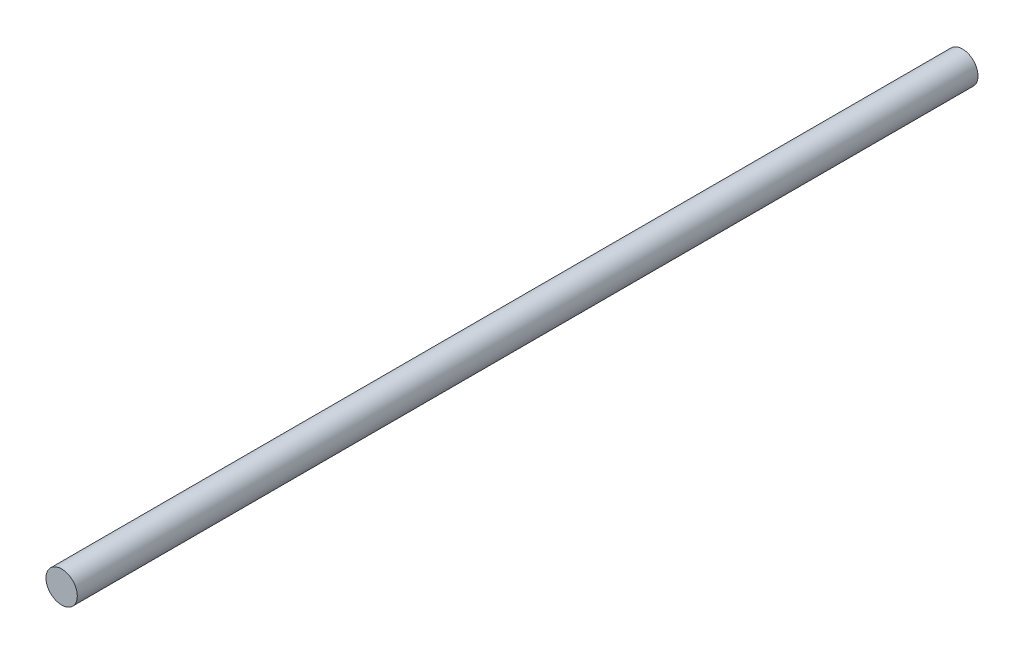
from build123d import *

# Parameters (mm, degrees)
SKETCH1_R           = 4
BOSS_EXTRUDE1_DEPTH = 230


with BuildPart() as part:
    # Sketch1 → Boss-Extrude1 (new body)
    with BuildSketch(Plane.XY):
        Circle(SKETCH1_R)
    extrude(amount=BOSS_EXTRUDE1_DEPTH)


solid = part.part
